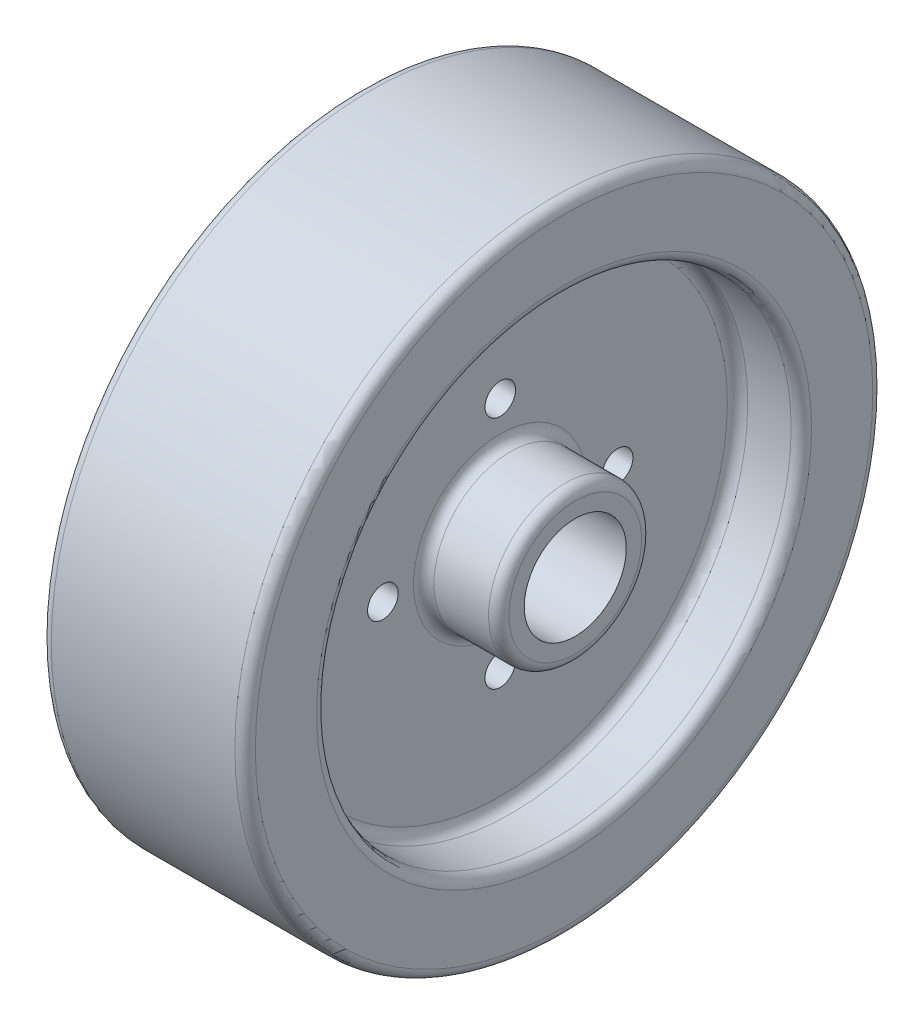
from build123d import *

# Parameters (mm, degrees)
FILLET1_R             = 2
SKETCH2_R             = 10
CENTREBORED_OUT_DEPTH = 99.913396464
SKETCH3_R             = 3
CUT_EXTRUDE2_DEPTH    = 20


with BuildPart() as part:
    # Sketch1 → Revolve1 (revolve)
    with BuildSketch(Plane.XY, mode=Mode.PRIVATE) as revolve1_sk:
        Polygon((-20, -62.5), (20, -62.5), (20, -46.5), (7.5, -46.5), (7.5, -15), (22.2, -15), (22.2, -6), (-22.2, -6), (-22.2, -15), (-7.5, -15), (-7.5, -46.5), (-20, -46.5), align=None)
    revolve(revolve1_sk.sketch.rotate(Axis((0, 0, 0), (1, 0, 0)), 270), axis=Axis((0, 0, 0), (1, 0, 0)))

    # Fillet1
    fillet1_edges = [part.edges().sort_by_distance(p)[0] for p in [
        (-7.5, 0, -15),
        (-22.2, 0, -15),
        (22.2, 0, -15),
        (7.5, 0, -15),
        (7.5, 0, -46.5),
        (20, 0, -46.5),
        (20, 0, -62.5),
        (-20, 0, -62.5),
        (-20, 0, -46.5),
        (-7.5, 0, -46.5),
    ]]
    fillet(fillet1_edges, radius=FILLET1_R)

    # Sketch2 → centrebored out (cut, through all)
    with BuildSketch(Plane.ZY.offset(22.2)):
        Circle(SKETCH2_R)
    extrude(amount=-CENTREBORED_OUT_DEPTH, mode=Mode.SUBTRACT)

    # Sketch3 → Cut-Extrude2 (cut)
    with BuildSketch(Plane.ZY.offset(7.5)):
        with Locations((0, 23)):
            Circle(SKETCH3_R)
        with Locations((23, 0)):
            Circle(SKETCH3_R)
        with Locations((0, -23)):
            Circle(SKETCH3_R)
        with Locations((-23, 0)):
            Circle(SKETCH3_R)
    extrude(amount=-CUT_EXTRUDE2_DEPTH, mode=Mode.SUBTRACT)


solid = part.part
